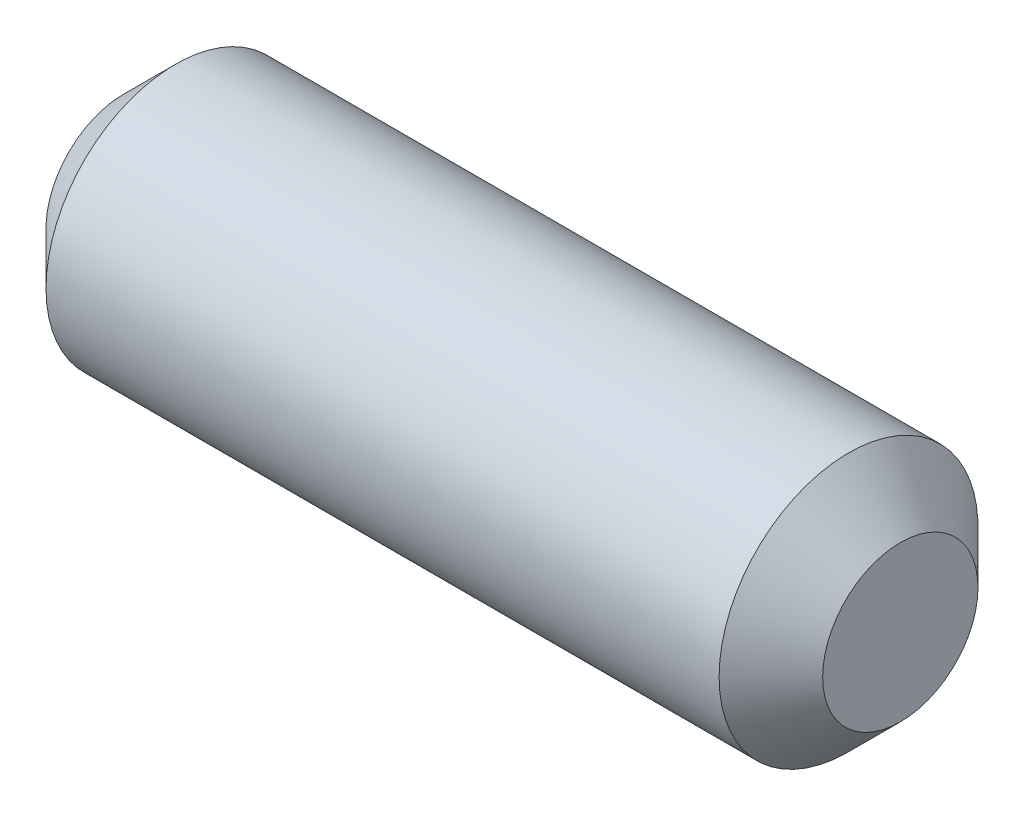
from build123d import *

# Parameters (mm, degrees)
SKETCH2_R           = 3.175
BOSS_EXTRUDE1_DEPTH = 19.05
CHAMFER1_SIZE       = 1.27


with BuildPart() as part:
    # Sketch2 → Boss-Extrude1 (new body)
    with BuildSketch(Plane(origin=(0, 0, 0), x_dir=(0, 0, -1), z_dir=(1, 0, 0))):
        with Locations(Location((0, 0, 0), (0, 0, 180))):
            Circle(SKETCH2_R)
    extrude(amount=BOSS_EXTRUDE1_DEPTH)

    # Chamfer1
    chamfer1_edges = [part.edges().sort_by_distance(p)[0] for p in [
        (0, 0, -3.175),
        (19.05, 0, -3.175),
    ]]
    chamfer(chamfer1_edges, length=CHAMFER1_SIZE)


solid = part.part
